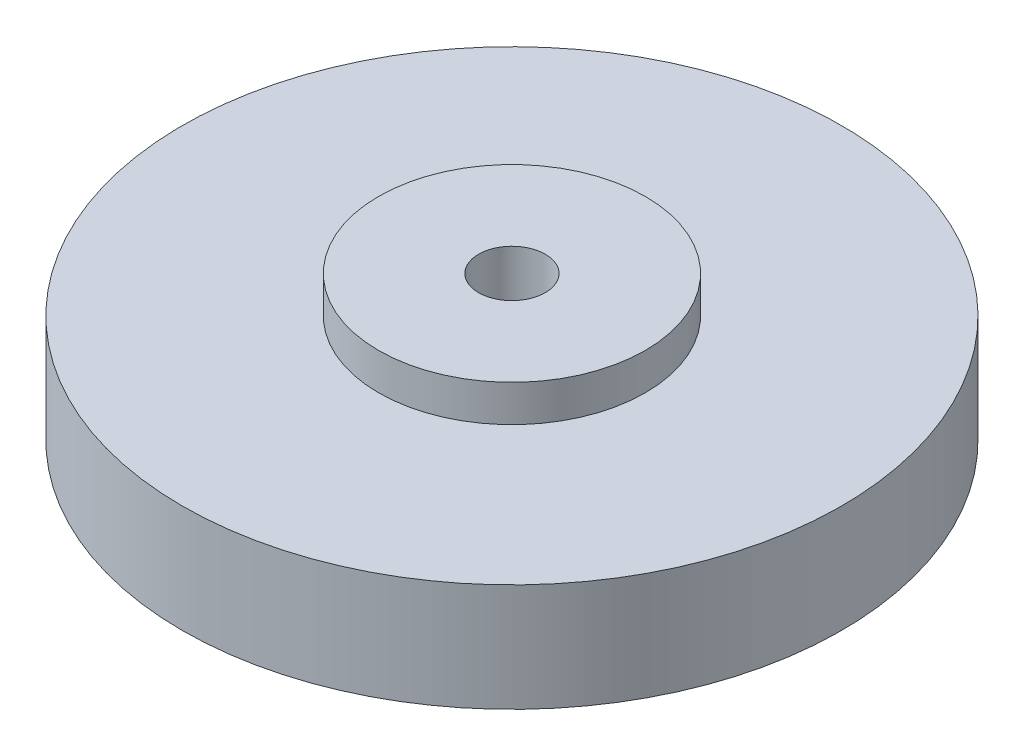
from build123d import *

# Parameters (mm, degrees)
SKETCH1_R           = 14.825
BOSS_EXTRUDE1_DEPTH = 4.85
SKETCH2_R           = 6
BOSS_EXTRUDE2_DEPTH = 1.65
SKETCH3_R           = 1.5
CUT_EXTRUDE1_DEPTH  = 22.950199316


with BuildPart() as part:
    # Sketch1 → Boss-Extrude1 (new body)
    with BuildSketch(Plane(origin=(0, 0, 0), x_dir=(1, 0, 0), z_dir=(0, 1, 0))):
        with Locations(Location((0, 0, 0), (0, 0, 270))):
            Circle(SKETCH1_R)
    extrude(amount=BOSS_EXTRUDE1_DEPTH)

    # Sketch2 → Boss-Extrude2 (add)
    with BuildSketch(Plane(origin=(0, 4.85, 0), x_dir=(1, 0, 0), z_dir=(0, 1, 0))):
        with Locations(Location((0, 0, 0), (0, 0, 270))):
            Circle(SKETCH2_R)
    extrude(amount=BOSS_EXTRUDE2_DEPTH)

    # Sketch3 → Cut-Extrude1 (cut, through all)
    with BuildSketch(Plane(origin=(0, 6.5, 0), x_dir=(1, 0, 0), z_dir=(0, 1, 0))):
        with Locations(Location((0, 0, 0), (0, 0, 270))):
            Circle(SKETCH3_R)
    extrude(amount=-CUT_EXTRUDE1_DEPTH, mode=Mode.SUBTRACT)


solid = part.part
